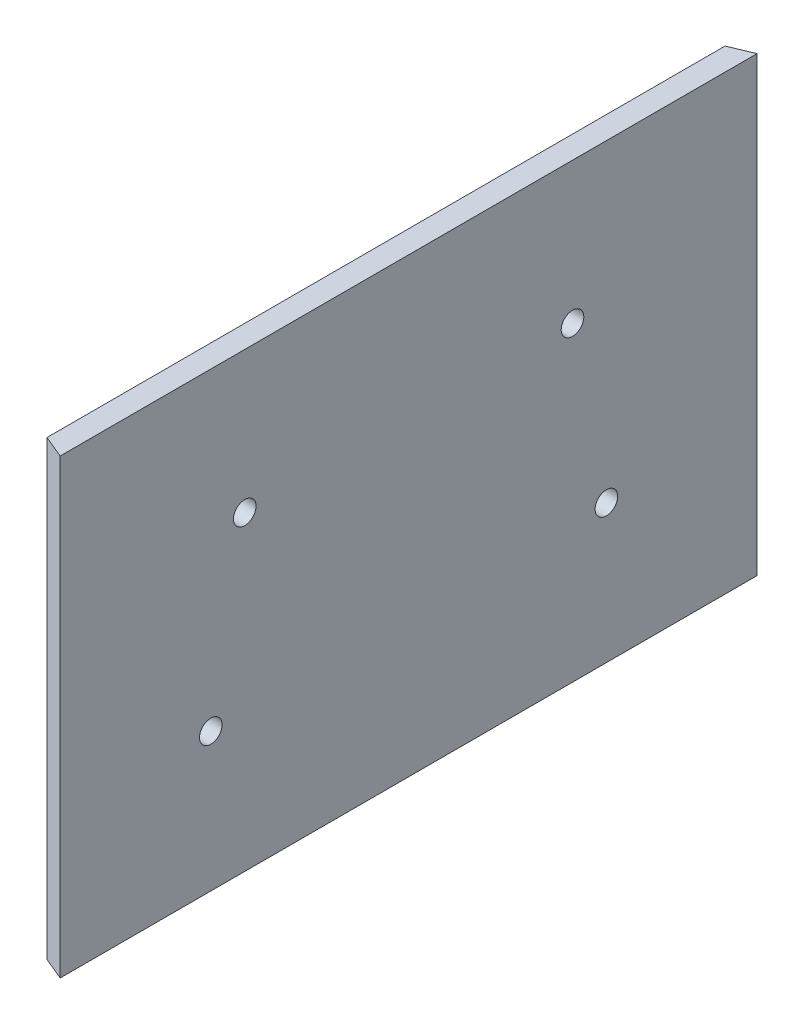
from build123d import *

# Parameters (mm, degrees)
SKETCH_1_W          = 4
SKETCH_1_H          = 80
EXTRUDE_3_DEPTH     = 120
SKETCH_3_R          = 2
CUT_EXTRUDE_1_DEPTH = 131.061523903
EXTRUDE_4_DEPTH     = 80


with BuildPart() as part:
    # 草图1 → 拉伸3 (new body)
    with BuildSketch(Plane.XY):
        with Locations((-2, 10)):
            Rectangle(SKETCH_1_W, SKETCH_1_H)
    extrude(amount=-EXTRUDE_3_DEPTH)

    # 草图3 → 切除-拉伸1 (cut, through all)
    with BuildSketch(Plane.ZY.offset(4)):
        with Locations(Location((-89, 25, 0), (0, 0, 270))):
            Circle(SKETCH_3_R)
        with Locations(Location((-95, -5.5, 0), (0, 0, 270))):
            Circle(SKETCH_3_R)
        with Locations(Location((-25, -5.5, 0), (0, 0, 90))):
            Circle(SKETCH_3_R)
        with Locations(Location((-31, 25, 0), (0, 0, 90))):
            Circle(SKETCH_3_R)
    extrude(amount=-CUT_EXTRUDE_1_DEPTH, mode=Mode.SUBTRACT)

    # 草图4 → 拉伸4 (add)
    with BuildSketch(Plane(origin=(0, 50, 0), x_dir=(-1, 0, 0), z_dir=(0, 1, 0))):
        Polygon((4, 0), (0, 1.656854249), (0, 0), align=None)
        Polygon((4, -120), (0, -120), (0, -121.656854249), align=None)
    extrude(amount=-EXTRUDE_4_DEPTH)


solid = part.part
